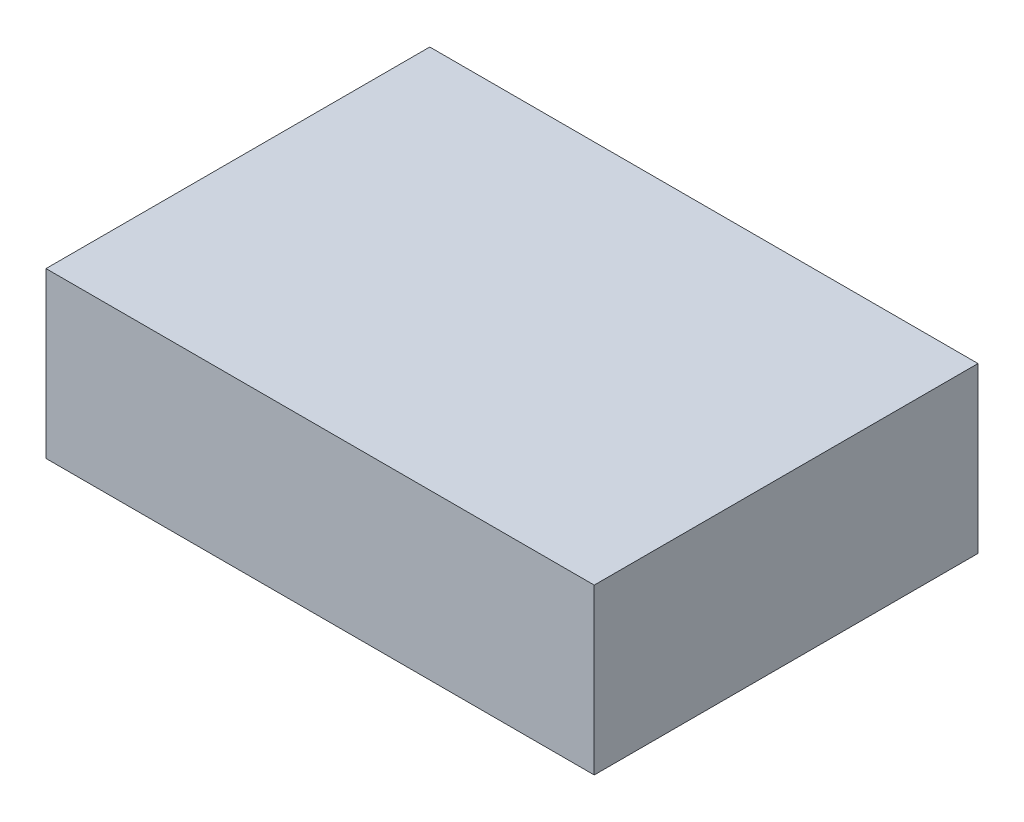
from build123d import *

# Parameters (mm, degrees)
SKETCH1_W           = 100
SKETCH1_H           = 70
BOSS_EXTRUDE1_DEPTH = 30


with BuildPart() as part:
    # Sketch1 → Boss-Extrude1 (new body)
    with BuildSketch(Plane(origin=(0, 0, 0), x_dir=(1, 0, 0), z_dir=(0, 1, 0))):
        with Locations((-6.298208551, 9.752865237)):
            Rectangle(SKETCH1_W, SKETCH1_H)
    extrude(amount=BOSS_EXTRUDE1_DEPTH)


solid = part.part
